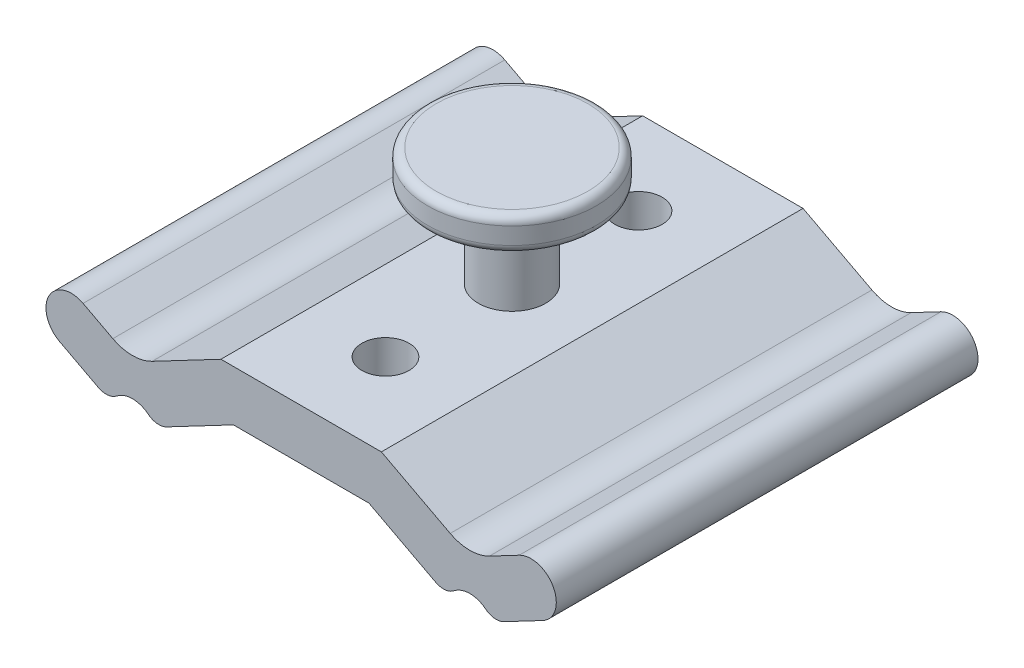
from build123d import *

# Parameters (mm, degrees)
EXTRUIR_L_MINA1_DEPTH           = 25
REDONDEO1_R                     = 5
CROQUIS2_R                      = 3
CORTAR_EXTRUIR1_DEPTH           = 41.555257948
REDONDEO2_RADIUS                = 3
REDONDEO2_LENGTH                = 50
REDONDEO3_R                     = 2
REDONDEO1_OF_SIMETR_A1_R        = 5
REDONDEO2_OF_SIMETR_A1_2_RADIUS = 3
REDONDEO2_OF_SIMETR_A1_2_LENGTH = 50
REDONDEO3_OF_SIMETR_A1_R        = 2
TALADRO2_D                      = 5.6
REDONDEO4_R                     = 1


with BuildPart() as part:
    # Croquis1 → Extruir-Lámina1 (new, symmetric)
    with BuildSketch(Plane.XY):
        Polygon((0, 0), (8.029231721, 0), (20, -6.300526927), (31.305467696, -0.350165014), (28.510946527, 4.959321914), (20, 0.479789229), (9.511803576, 6), (0, 6), align=None)
    extruir_l_mina1 = extrude(amount=EXTRUIR_L_MINA1_DEPTH, both=True)

    # Redondeo1
    redondeo1_edges = [part.edges().sort_by_distance(p)[0] for p in [
        (20, 0.479789229, 0),
    ]]
    fillet(redondeo1_edges, radius=REDONDEO1_R)

    # Croquis2 → Cortar-Extruir1 (cut, symmetric)
    with BuildSketch(Plane.XY):
        with Locations((20, -6.300526927)):
            Circle(CROQUIS2_R)
    cortar_extruir1 = extrude(amount=CORTAR_EXTRUIR1_DEPTH, both=True, mode=Mode.SUBTRACT)

    # Redondeo2: full round fillet: the end face becomes a half cylinder, R = half its width
    redondeo2_face = Plane((29.908207112, 2.30457845, 0), x_dir=(0, 0, 1), z_dir=(0.884914487987, 0.465753528113, 0))  # on the end face: x along it, z out of the body
    redondeo2_slab = redondeo2_face.offset(-REDONDEO2_RADIUS / 2) * Box(REDONDEO2_LENGTH, 2 * REDONDEO2_RADIUS, REDONDEO2_RADIUS, mode=Mode.PRIVATE)  # the body's end, R deep
    redondeo2_round = Plane((27.253463648, 0.907317866, 0), x_dir=(0.884914487987, 0.465753528113, 0), z_dir=(0, 0, 1)) * Cylinder(REDONDEO2_RADIUS, REDONDEO2_LENGTH, mode=Mode.PRIVATE)  # its axis R under the face
    add(redondeo2_slab - redondeo2_round, mode=Mode.SUBTRACT)

    # Redondeo3
    redondeo3_edges = [part.edges().sort_by_distance(p)[0] for p in [
        (22.654743464, -4.903266343, 0),
        (17.345256536, -4.903266343, 0),
    ]]
    fillet(redondeo3_edges, radius=REDONDEO3_R)

    # Simetría1: Extruir-Lámina1, Cortar-Extruir1 across plane
    add(extruir_l_mina1.mirror(Plane(origin=(0, 0, 0), x_dir=(0, 0, 1), z_dir=(1, 0, 0))))
    add(cortar_extruir1.mirror(Plane(origin=(0, 0, 0), x_dir=(0, 0, 1), z_dir=(1, 0, 0))), mode=Mode.SUBTRACT)

    # Redondeo1 of Simetría1
    redondeo1_of_simetr_a1_edges = [part.edges().sort_by_distance(p)[0] for p in [
        (-20, 0.479789229, 0),
    ]]
    fillet(redondeo1_of_simetr_a1_edges, radius=REDONDEO1_OF_SIMETR_A1_R)

    # Redondeo2 of Simetr_a1 2: full round fillet: the end face becomes a half cylinder, R = half its width
    redondeo2_of_simetr_a1_2_face = Plane((-29.908207112, 2.30457845, 0), x_dir=(0, 0, 1), z_dir=(-0.884914487987, 0.465753528113, 0))  # on the end face: x along it, z out of the body
    redondeo2_of_simetr_a1_2_slab = redondeo2_of_simetr_a1_2_face.offset(-REDONDEO2_OF_SIMETR_A1_2_RADIUS / 2) * Box(REDONDEO2_OF_SIMETR_A1_2_LENGTH, 2 * REDONDEO2_OF_SIMETR_A1_2_RADIUS, REDONDEO2_OF_SIMETR_A1_2_RADIUS, mode=Mode.PRIVATE)  # the body's end, R deep
    redondeo2_of_simetr_a1_2_round = Plane((-27.253463648, 0.907317866, 0), x_dir=(-0.884914487987, 0.465753528113, 0), z_dir=(0, 0, 1)) * Cylinder(REDONDEO2_OF_SIMETR_A1_2_RADIUS, REDONDEO2_OF_SIMETR_A1_2_LENGTH, mode=Mode.PRIVATE)  # its axis R under the face
    add(redondeo2_of_simetr_a1_2_slab - redondeo2_of_simetr_a1_2_round, mode=Mode.SUBTRACT)

    # Redondeo3 of Simetría1
    redondeo3_of_simetr_a1_edges = [part.edges().sort_by_distance(p)[0] for p in [
        (-22.654743464, -4.903266343, 0),
        (-17.345256536, -4.903266343, 0),
    ]]
    fillet(redondeo3_of_simetr_a1_edges, radius=REDONDEO3_OF_SIMETR_A1_R)

    # Taladro2 (through all)
    with Locations(Plane(origin=(0, 6, 0), x_dir=(1, 0, 0), z_dir=(0, 1, 0))):
        with Locations((0, 15), (0, -15)):
            Hole(TALADRO2_D / 2)

    # Croquis5 → Revolución1 (revolve)
    with BuildSketch(Plane.XY, mode=Mode.PRIVATE) as revoluci_n1_sk:
        Polygon((0, 0), (0, 20), (10, 20), (10, 16), (4, 16), (4, 0), align=None)
    revolve(revoluci_n1_sk.sketch.rotate(Axis((0, 0, 0), (0, 1, 0)), 90), axis=Axis((0, 0, 0), (0, 1, 0)))

    # Redondeo4
    redondeo4_edges = [part.edges().sort_by_distance(p)[0] for p in [
        (0, 20, 10),
        (0, 16, 10),
        (0, 16, 4),
    ]]
    fillet(redondeo4_edges, radius=REDONDEO4_R)


solid = part.part
